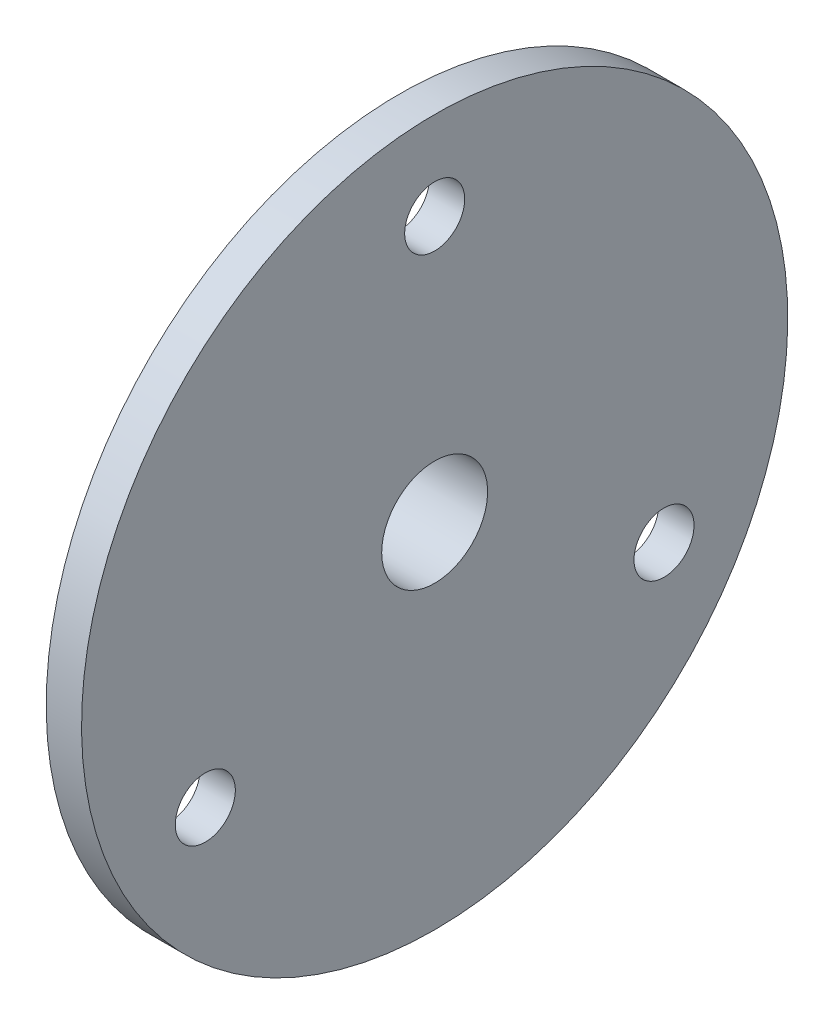
from build123d import *

# Parameters (mm, degrees)
DIAM_TRE_DU_PER_AGE_6_0_6_1_D = 6
TROU_TARAUD_M4X0_71_D         = 3.3
TROU_TARAUD_M4X0_71_DEPTH     = 4
TROU_TARAUD_M4X0_71_TIP       = 0.991420021
D_GAGEMENT_M31_D              = 3.4


with BuildPart() as part:
    # Esquisse1 → Révolution1 (revolve)
    with BuildSketch(Plane.XY, mode=Mode.PRIVATE) as r_volution1_sk:
        Polygon((-1, 0), (1, 0), (1, 20), (-1, 20), (-1, 5), (-8, 5), (-8, 0), align=None)
    revolve(r_volution1_sk.sketch.rotate(Axis((-1031.231063335, 0, 0), (1, 0, 0)), 180), axis=Axis((-1031.231063335, 0, 0), (1, 0, 0)))

    # Diamètre du perçage Ø6.0 (6)1 (through all)
    with Locations(Plane.ZY.offset(8)):
        with Locations((0, 0)):
            Hole(DIAM_TRE_DU_PER_AGE_6_0_6_1_D / 2)

    # Trou taraudé M4x0.71
    with Locations(Plane(origin=(-4.5, 5, 0), x_dir=(0, 0, 1), z_dir=(0, 1, 0))):
        with Locations((0, 0)):
            Hole(TROU_TARAUD_M4X0_71_D / 2, depth=TROU_TARAUD_M4X0_71_DEPTH)
            with Locations((0, 0, -(TROU_TARAUD_M4X0_71_DEPTH + TROU_TARAUD_M4X0_71_TIP / 2))):  # 118° drill point
                Cone(0, TROU_TARAUD_M4X0_71_D / 2, TROU_TARAUD_M4X0_71_TIP, mode=Mode.SUBTRACT)

    # Dégagement M31 (through all)
    with Locations(Plane.ZY.offset(1)):
        with Locations((0, 15), (12.990381057, -7.5), (-12.990381057, -7.5)):
            Hole(D_GAGEMENT_M31_D / 2)


solid = part.part
